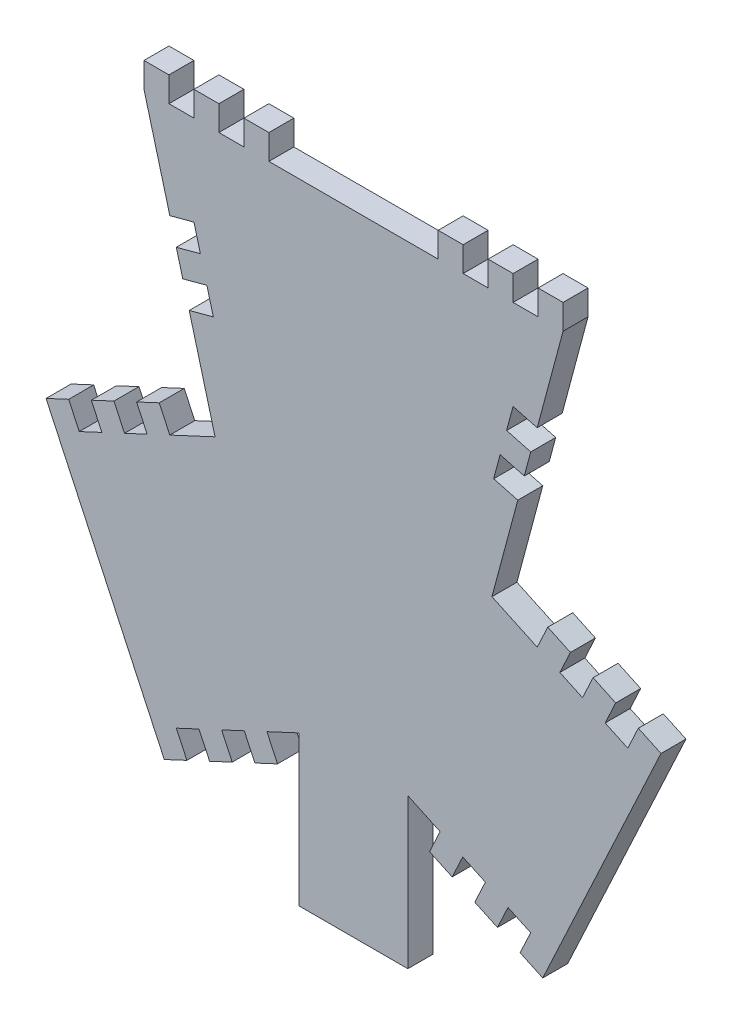
from build123d import *

# Parameters (mm, degrees)
BOSS_EXTRU_1_DEPTH = 5


with BuildPart() as part:
    # Esquisse1 → Boss.-Extru.1 (new body)
    with BuildSketch(Plane.XY):
        Polygon((-88.082046911, 23.788138558), (-84.199761229, 9.299251145), (-82.905666004, 4.469622013), (-91.968743874, 0.243439396), (-94.081835183, 4.774978331), (-98.613374118, 2.661887022), (-96.500282809, -1.869651913), (-101.031821745, -3.982743221), (-103.144913053, 0.548795714), (-107.676451989, -1.564295595), (-105.56336068, -6.09583453), (-110.094899615, -8.208925839), (-112.207990924, -3.677386904), (-116.739529859, -5.790478212), (-93.072907201, -56.543714286), (-88.541368266, -54.430622978), (-90.654459575, -49.899084043), (-86.12292064, -47.785992734), (-84.009829331, -52.317531669), (-79.478290396, -50.20444036), (-81.591381705, -45.672901425), (-77.059842769, -43.559810116), (-74.946751461, -48.091349052), (-70.415212525, -45.978257743), (-72.528303834, -41.446718808), (-66.073876495, -38.43696991), (-66.073876495, -68.43696991), (-44.325645964, -68.43696991), (-44.325645964, -38.43696991), (-37.871218625, -41.446718808), (-39.984309933, -45.978257743), (-35.452770998, -48.091349052), (-33.339679689, -43.559810116), (-28.808140754, -45.672901425), (-30.921232063, -50.20444036), (-26.389693128, -52.317531669), (-24.276601819, -47.785992734), (-19.745062884, -49.899084043), (-21.858154193, -54.430622978), (-17.326615257, -56.543714286), (6.3400074, -5.790478212), (1.808468465, -3.677386904), (-0.304622844, -8.208925839), (-4.836161779, -6.09583453), (-2.72307047, -1.564295595), (-7.254609405, 0.548795714), (-9.367700714, -3.982743221), (-13.899239649, -1.869651913), (-11.786148341, 2.661887022), (-16.317687276, 4.774978331), (-18.430778585, 0.243439396), (-27.493856455, 4.469622013), (-26.199761229, 9.299251145), (-22.317475548, 23.788138558), (-27.147224449, 25.081786714), (-25.853129223, 29.911415845), (-21.023380322, 28.617767689), (-19.729285097, 33.447396821), (-24.559033998, 34.741044977), (-23.265385842, 39.570793878), (-18.435636941, 38.277145722), (-13.259256039, 57.595662248), (-13.259256039, 62.595662248), (-18.259256039, 62.595662248), (-18.259256039, 57.595662248), (-23.259256039, 57.595662248), (-23.259256039, 62.595662248), (-28.259256039, 62.595662248), (-28.259256039, 57.595662248), (-33.259256039, 57.595662248), (-33.259256039, 62.595662248), (-38.259256039, 62.595662248), (-38.259256039, 57.595662248), (-72.14026642, 57.595662248), (-72.14026642, 62.595662248), (-77.14026642, 62.595662248), (-77.14026642, 57.595662248), (-82.14026642, 57.595662248), (-82.14026642, 62.595662248), (-87.14026642, 62.595662248), (-87.14026642, 57.595662248), (-92.14026642, 57.595662248), (-92.14026642, 62.595662248), (-97.14026642, 62.595662248), (-97.14026642, 57.595662248), (-91.963885518, 38.277145722), (-87.134136617, 39.570793878), (-85.840488461, 34.741044977), (-90.670237362, 33.447396821), (-89.376142136, 28.617767689), (-84.546393235, 29.911415845), (-83.25229801, 25.081786714), align=None)
    extrude(amount=BOSS_EXTRU_1_DEPTH)


solid = part.part
